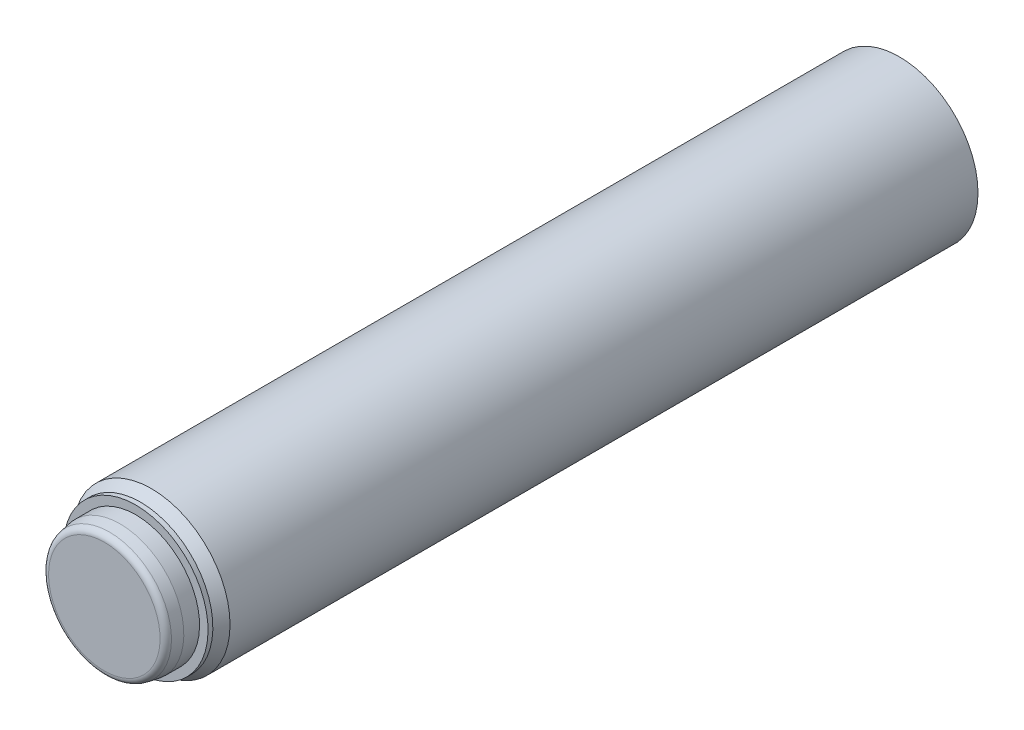
from build123d import *

# Parameters (mm, degrees)
CROQUIS1_R              = 12.5
SALIENTE_EXTRUIR1_DEPTH = 119
CROQUIS5_R              = 6
CORTAR_EXTRUIR1_DEPTH   = 30


with BuildPart() as part:
    # Croquis1 → Saliente-Extruir1 (new body)
    with BuildSketch(Plane.XY):
        Circle(CROQUIS1_R)
    extrude(amount=SALIENTE_EXTRUIR1_DEPTH)

    # Croquis4 → Revolución1 (revolve)
    with BuildSketch(Plane(origin=(0, 0, 0), x_dir=(0, 0, -1), z_dir=(1, 0, 0)), mode=Mode.PRIVATE) as revoluci_n1_sk:
        with BuildLine():
            Line((-119, 0), (-126.5, 0))
            Line((-126.5, 0), (-126.5, -8.870082917))
            ThreePointArc((-126.5, -8.870082917), (-126.266044443, -9.512870527), (-125.673648178, -9.85489067))
            Line((-125.673648178, -9.85489067), (-124, -10.15))
            Line((-124, -10.15), (-121.5, -10.15))
            Line((-121.5, -10.15), (-121.5, -11.5))
            Line((-121.5, -11.5), (-120.732050808, -11.5))
            Line((-120.732050808, -11.5), (-119, -12.5))
            Line((-119, -12.5), (-119, 0))
        make_face()
    revolve(revoluci_n1_sk.sketch.rotate(Axis((0, 0, 119), (0, 0, 1)), 180), axis=Axis((0, 0, 119), (0, 0, 1)))

    # Croquis5 → Cortar-Extruir1 (cut)
    with BuildSketch(Plane(origin=(0, 0, 0), x_dir=(-1, 0, 0), z_dir=(0, 0, -1))):
        Circle(CROQUIS5_R)
    extrude(amount=-CORTAR_EXTRUIR1_DEPTH, mode=Mode.SUBTRACT)


solid = part.part
